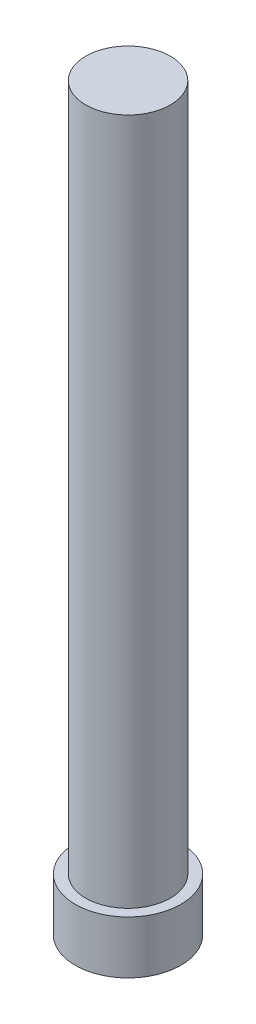
from build123d import *

# Parameters (mm, degrees)
SKETCH_1_R      = 4
EXTRUDE_1_DEPTH = 65
SKETCH_2_R      = 5
EXTRUDE_2_DEPTH = 5


with BuildPart() as part:
    # 草图1 → 凸台-拉伸1 (new body)
    with BuildSketch(Plane(origin=(0, 0, 0), x_dir=(1, 0, 0), z_dir=(0, 1, 0))):
        with Locations(Location((0, 0, 0), (0, 0, 270))):
            Circle(SKETCH_1_R)
    extrude(amount=EXTRUDE_1_DEPTH)

    # 草图2 → 凸台-拉伸2 (add)
    with BuildSketch(Plane.XZ):
        with Locations(Location((0, 0, 0), (0, 0, 270))):
            Circle(SKETCH_2_R)
    extrude(amount=EXTRUDE_2_DEPTH)


solid = part.part
